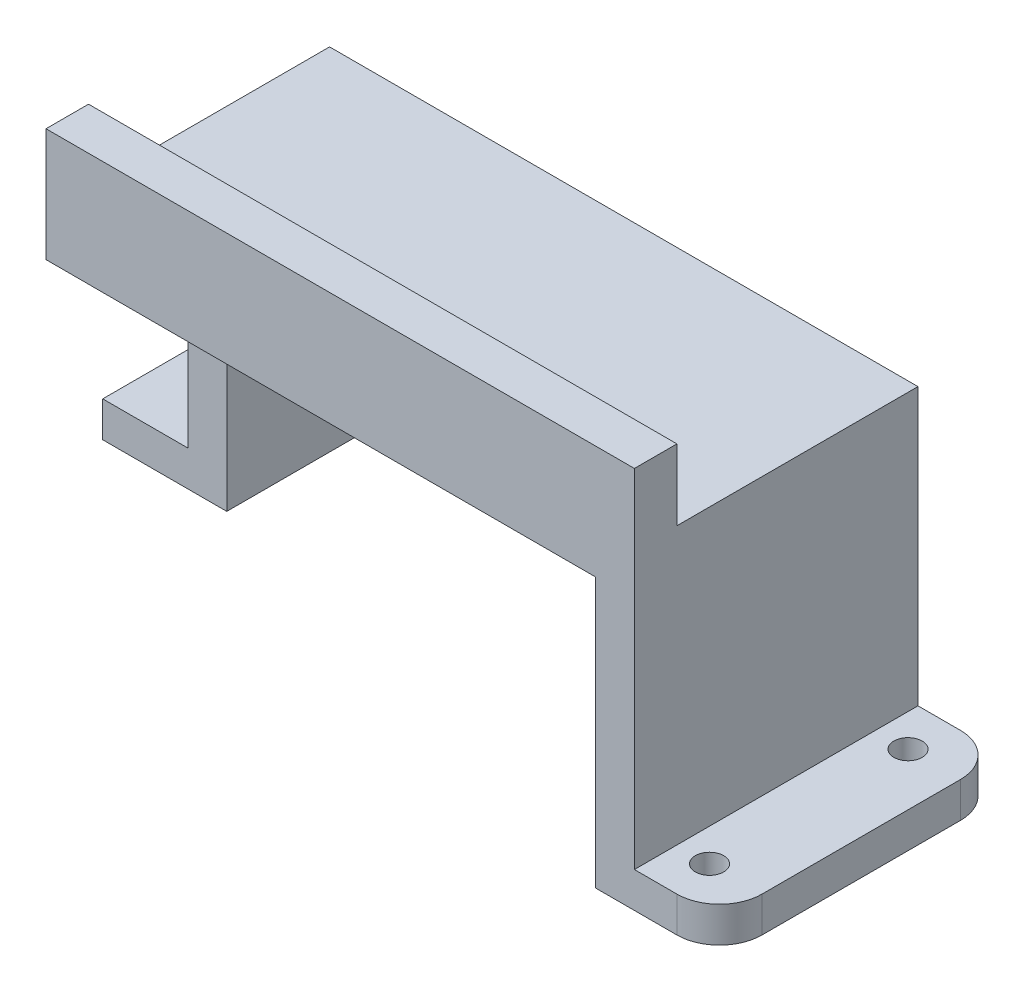
from build123d import *

# Parameters (mm, degrees)
BOSS_EXTRUDE1_DEPTH      = 33.5
SKETCH2_W                = 20
SKETCH2_H                = 2.5
BOSS_EXTRUDE2_DEPTH      = 6
SKETCH9_R                = 1
CORTE_EXTRUS_O1_DEPTH    = 48.67140128
FILETE1_R                = 3
ESBO_O12_W               = 41.5
ESBO_O12_H               = 3
RESSALTO_EXTRUS_O1_DEPTH = 5
FILETE1_OF_ESPELHAR1_R   = 3
ESBO_O14_W               = 12
ESBO_O14_H               = 19.002666305
CORTE_EXTRUS_O10_DEPTH   = 10
ESBO_O15_W               = 13.5
ESBO_O15_H               = 22.081303671
CORTE_EXTRUS_O11_DEPTH   = 62.469504634


with BuildPart() as part:
    # Sketch1 → Boss-Extrude1 (new body)
    with BuildSketch(Plane.XY):
        Polygon((19, -20), (21.75, -20), (21.75, 2), (-19.75, 2), (-19.75, -20), (-17, -20), (-17, -1), (19, -1), align=None)
    extrude(amount=BOSS_EXTRUDE1_DEPTH)

    # Sketch2 → Boss-Extrude2 (add)
    with BuildSketch(Plane(origin=(21.75, 0, 0), x_dir=(0, 0, -1), z_dir=(1, 0, 0))):
        with Locations((-23.5, -18.75)):
            Rectangle(SKETCH2_W, SKETCH2_H)
    boss_extrude2 = extrude(amount=BOSS_EXTRUDE2_DEPTH)

    # Sketch9 → Corte-extrusão1 (cut, through all)
    with BuildSketch(Plane(origin=(0, -17.5, 0), x_dir=(1, 0, 0), z_dir=(0, 1, 0))):
        with Locations(Location((24.05, -16.5, 0), (0, 0, 270))):
            Circle(SKETCH9_R)
        with Locations(Location((24.05, -30.5, 0), (0, 0, 270))):
            Circle(SKETCH9_R)
    corte_extrus_o1 = extrude(amount=-CORTE_EXTRUS_O1_DEPTH, mode=Mode.SUBTRACT)

    # Filete1
    filete1_edges = [part.edges().sort_by_distance(p)[0] for p in [
        (27.75, -18.75, 13.5),
        (27.75, -18.75, 33.5),
    ]]
    fillet(filete1_edges, radius=FILETE1_R)

    # Esboço12 → Ressalto-extrusão1 (add)
    with BuildSketch(Plane(origin=(0, 2, 0), x_dir=(1, 0, 0), z_dir=(0, 1, 0))):
        with Locations((1, -32)):
            Rectangle(ESBO_O12_W, ESBO_O12_H)
    extrude(amount=RESSALTO_EXTRUS_O1_DEPTH)

    # Espelhar1: Boss-Extrude2, Corte-extrusão1 across plane
    add(boss_extrude2.mirror(Plane(origin=(1, 0, 0), x_dir=(0, 0, 1), z_dir=(1, 0, 0))))
    add(corte_extrus_o1.mirror(Plane(origin=(1, 0, 0), x_dir=(0, 0, 1), z_dir=(1, 0, 0))), mode=Mode.SUBTRACT)

    # Filete1 of Espelhar1
    filete1_of_espelhar1_edges = [part.edges().sort_by_distance(p)[0] for p in [
        (-25.75, -18.75, 13.5),
        (-25.75, -18.75, 33.5),
    ]]
    fillet(filete1_of_espelhar1_edges, radius=FILETE1_OF_ESPELHAR1_R)

    # Esboço14 → Corte-extrusão10 (cut)
    with BuildSketch(Plane.XY.offset(33.5)):
        with Locations((-23, -10.498666848)):
            Rectangle(ESBO_O14_W, ESBO_O14_H)
    extrude(amount=-CORTE_EXTRUS_O10_DEPTH, mode=Mode.SUBTRACT)

    # Esboço15 → Corte-extrusão11 (cut, through all)
    with BuildSketch(Plane.ZY.offset(19.75)):
        with Locations((6.75, -8.959348164)):
            Rectangle(ESBO_O15_W, ESBO_O15_H)
    extrude(amount=-CORTE_EXTRUS_O11_DEPTH, mode=Mode.SUBTRACT)


solid = part.part
